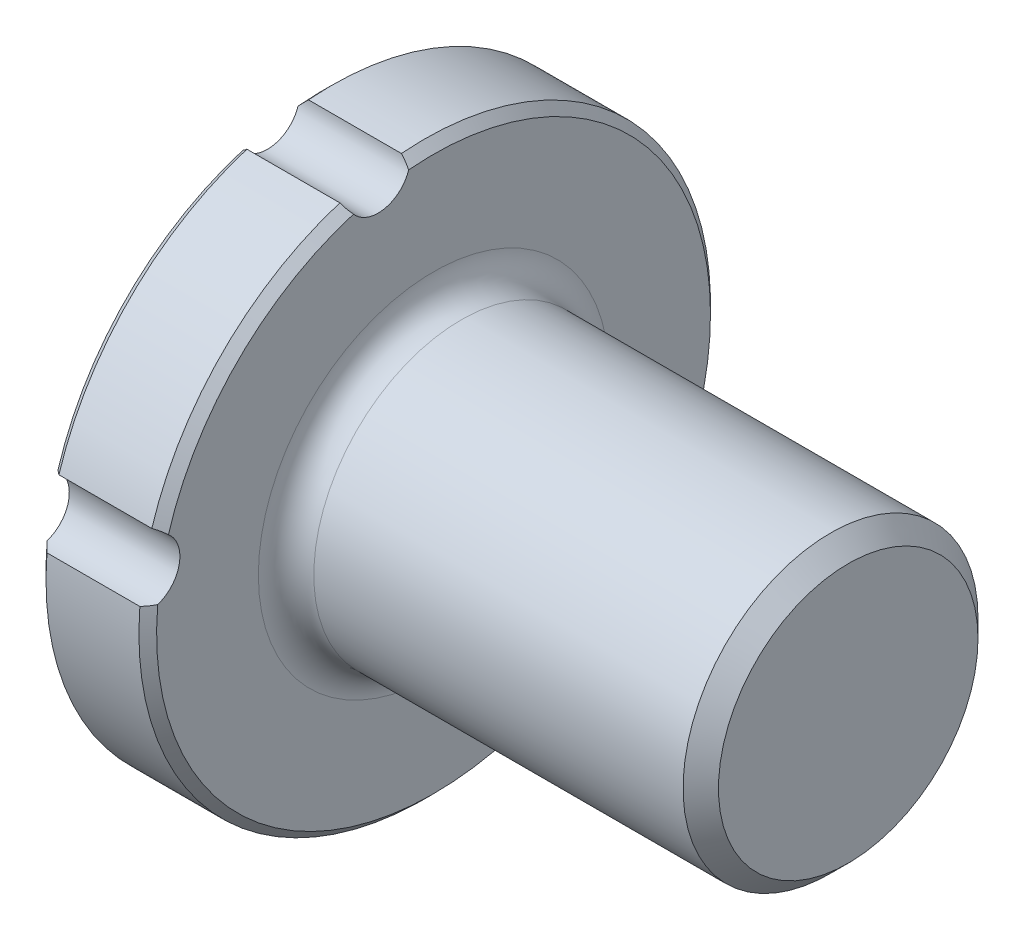
from build123d import *

# Parameters (mm, degrees)
SKETCH1_R           = 24.6126
BOSS_EXTRUDE1_DEPTH = 9.525
BOSS_EXTRUDE2_START = 9.525
SKETCH2_R           = 12.7
BOSS_EXTRUDE2_DEPTH = 35.7124
SKETCH3_R           = 8.7122
BOSS_EXTRUDE4_DEPTH = 4.826
SKETCH4_R           = 2.7686
CUT_EXTRUDE2_DEPTH  = 58.078739617
FILLET1_R           = 0.381
FILLET2_R           = 2.3876
CHAMFER1_SIZE       = 0.762
CHAMFER2_SIZE       = 1.524


with BuildPart() as part:
    # Sketch1 → Boss-Extrude1 (new body)
    with BuildSketch(Plane.YZ):
        with Locations(Location((0, 0, 0), (0, 0, 270))):
            Circle(SKETCH1_R)
    extrude(amount=BOSS_EXTRUDE1_DEPTH)

    # Sketch2 → Boss-Extrude2 (add)
    with BuildSketch(Plane.YZ.offset(BOSS_EXTRUDE2_START)):
        with Locations(Location((0, 0, 0), (0, 0, 270))):
            Circle(SKETCH2_R)
    extrude(amount=BOSS_EXTRUDE2_DEPTH)

    # Sketch3 → Boss-Extrude4 (add)
    with BuildSketch(Plane.YZ):
        with Locations(Location((0, 0, 0), (0, 0, 270))):
            Circle(SKETCH3_R)
    extrude(amount=-BOSS_EXTRUDE4_DEPTH)

    # Sketch4 → Cut-Extrude2 (cut, through all)
    with BuildSketch(Plane.YZ):
        with Locations((24.6126, 44.45)):
            Circle(SKETCH4_R)
        with Locations((44.45, 24.6126)):
            Circle(SKETCH4_R)
        with Locations((24.6126, 4.7752)):
            Circle(SKETCH4_R)
        with Locations((4.7752, 24.6126)):
            Circle(SKETCH4_R)
    extrude(amount=CUT_EXTRUDE2_DEPTH, mode=Mode.SUBTRACT)

    # Fillet1
    fillet1_edges = [part.edges().sort_by_distance(p)[0] for p in [
        (0, 0, 8.7122),
    ]]
    fillet(fillet1_edges, radius=FILLET1_R)

    # Fillet2
    fillet2_edges = [part.edges().sort_by_distance(p)[0] for p in [
        (9.525, 0, 12.7),
    ]]
    fillet(fillet2_edges, radius=FILLET2_R)

    # Chamfer1
    chamfer1_edges = [part.edges().sort_by_distance(p)[0] for p in [
        (0, 17.403736363, 17.403736363),
        (0, -17.403736363, -17.403736363),
        (9.525, 17.403736363, 17.403736363),
        (9.525, -17.403736363, -17.403736363),
    ]]
    chamfer(chamfer1_edges, length=CHAMFER1_SIZE)

    # Chamfer2
    chamfer2_edges = [part.edges().sort_by_distance(p)[0] for p in [
        (45.2374, 0, 12.7),
    ]]
    chamfer(chamfer2_edges, length=CHAMFER2_SIZE)


solid = part.part
